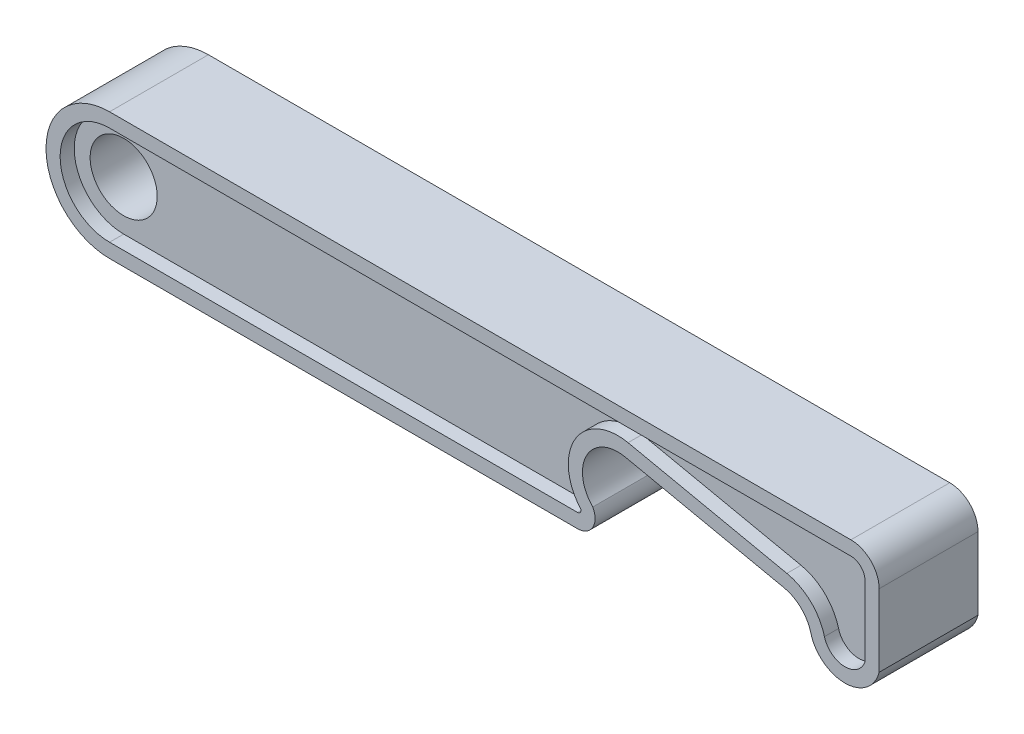
from build123d import *
from build123d.topology import SkipClean

# Parameters (mm, degrees)
BOSS_EXTRUDE1_DEPTH = 5
BOSS_EXTRUDE2_START = -12
BOSS_EXTRUDE2_DEPTH = 14


with BuildPart() as part:
    # Sketch1 → Boss-Extrude1 (new, symmetric)
    with SkipClean():  # the faces are left unmerged after this step: merging them gives an invalid solid
        with BuildSketch(Plane.XY):
            with BuildLine():
                ThreePointArc((9, 0), (6.363961031, -6.363961031), (0, -9))
                Line((0, -9), (66.272706331, -9))
                ThreePointArc((66.272706331, -9), (68.43776984, -7.75), (68.43776984, -5.25))
                ThreePointArc((68.43776984, -5.25), (67.583242863, 0.670186682), (73.015870906, 3.173260641))
                Line((73.015870906, 3.173260641), (95.515870906, -1.609261996))
                ThreePointArc((95.515870906, -1.609261996), (97.934586459, -2.888858783), (99.317541634, -5.25))
                ThreePointArc((99.317541634, -5.25), (104.158770817, -9), (109, -5.25))
                Line((109, -5.25), (109, 5))
                ThreePointArc((109, 5), (107.828427125, 7.828427125), (105, 9))
                Line((105, 9), (0, 9))
                ThreePointArc((0, 9), (6.363961031, 6.363961031), (9, 0))
            make_face()
            with BuildLine():
                ThreePointArc((-9, 0), (-6.363961031, -6.363961031), (0, -9))
                ThreePointArc((0, -9), (6.363961031, -6.363961031), (9, 0))
                Line((9, 0), (4.75, 0))
                ThreePointArc((4.75, 0), (0, -4.75), (-4.75, 0))
                Line((-4.75, 0), (-9, 0))
            make_face()
            with BuildLine():
                ThreePointArc((0, 9), (-6.363961031, 6.363961031), (-9, 0))
                Line((-9, 0), (-4.75, 0))
                ThreePointArc((-4.75, 0), (0, 4.75), (4.75, 0))
                Line((4.75, 0), (9, 0))
                ThreePointArc((9, 0), (6.363961031, 6.363961031), (0, 9))
            make_face()
            with BuildLine():
                ThreePointArc((-9, 0), (-6.363961031, -6.363961031), (0, -9))
                ThreePointArc((0, -9), (6.363961031, -6.363961031), (9, 0))
                Line((9, 0), (4.75, 0))
                ThreePointArc((4.75, 0), (0, -4.75), (-4.75, 0))
                Line((-4.75, 0), (-9, 0))
            make_face()
            with BuildLine():
                ThreePointArc((0, 9), (-6.363961031, 6.363961031), (-9, 0))
                Line((-9, 0), (-4.75, 0))
                ThreePointArc((-4.75, 0), (0, 4.75), (4.75, 0))
                Line((4.75, 0), (9, 0))
                ThreePointArc((9, 0), (6.363961031, 6.363961031), (0, 9))
            make_face()
        extrude(amount=BOSS_EXTRUDE1_DEPTH, both=True)

    # Sketch2 → Boss-Extrude2 (add)
    with SkipClean():  # the faces are left unmerged after this step: merging them gives an invalid solid
        with BuildSketch(Plane.XY.offset(5).offset(BOSS_EXTRUDE2_START)):
            with BuildLine():
                Line((105, 9), (0, 9))
                ThreePointArc((0, 9), (-9, 0), (0, -9))
                Line((0, -9), (66.272706331, -9))
                ThreePointArc((66.272706331, -9), (68.43776984, -7.75), (68.43776984, -5.25))
                ThreePointArc((68.43776984, -5.25), (67.583242863, 0.670186682), (73.015870906, 3.173260641))
                Line((73.015870906, 3.173260641), (95.515870906, -1.609261996))
                ThreePointArc((95.515870906, -1.609261996), (97.934586459, -2.888858783), (99.317541634, -5.25))
                ThreePointArc((99.317541634, -5.25), (104.158770817, -9), (109, -5.25))
                Line((109, -5.25), (109, 5))
                ThreePointArc((109, 5), (107.828427125, 7.828427125), (105, 9))
            make_face()
            with BuildLine():
                Line((105, 7), (0, 7))
                ThreePointArc((0, 7), (-7, 0), (0, -7))
                Line((0, -7), (66.272706331, -7))
                ThreePointArc((66.272706331, -7), (66.664953896, -6.810067489), (66.7591992, -6.38456739))
                ThreePointArc((66.7591992, -6.38456739), (65.919794123, 1.792306924), (73.431694287, 5.129555843))
                Line((73.431694287, 5.129555843), (95.931694287, 0.347033205))
                ThreePointArc((95.931694287, 0.347033205), (99.317896062, -1.444402296), (101.254033308, -4.75))
                ThreePointArc((101.254033308, -4.75), (104.047625793, -6.997940424), (107, -4.963024782))
                Line((107, -4.963024782), (107, 5))
                ThreePointArc((107, 5), (106.414213562, 6.414213562), (105, 7))
            make_face(mode=Mode.SUBTRACT)
        extrude(amount=BOSS_EXTRUDE2_DEPTH)


solid = part.part
